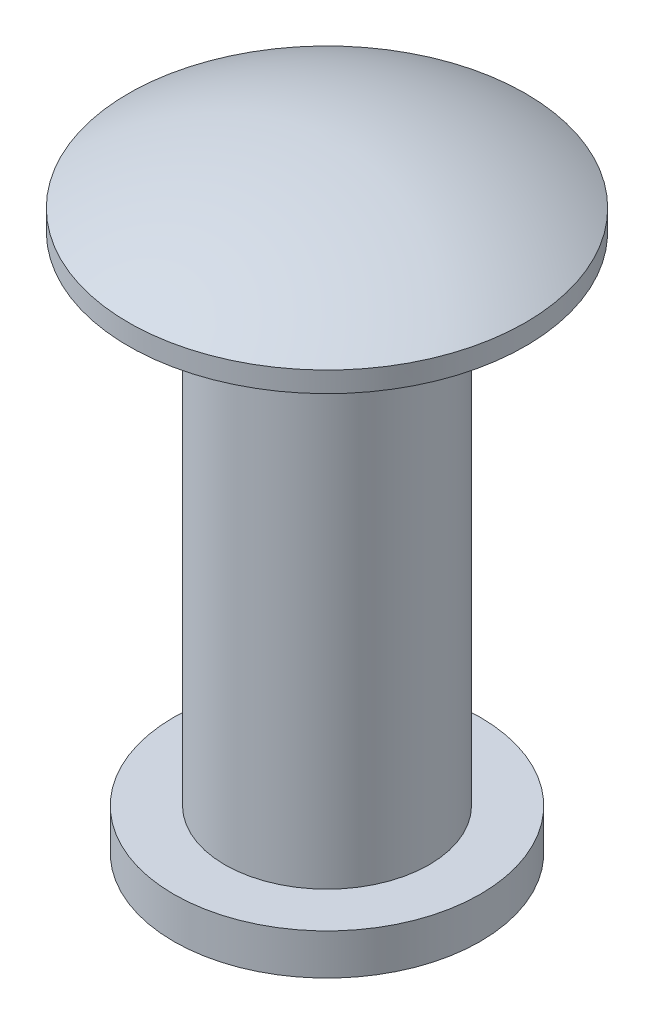
from build123d import *

# Parameters (mm, degrees)
SKETCH_1_W = 4.711910786
SKETCH_1_H = 1


with BuildPart() as part:
    # Эскиз1 → Повернуть1 (revolve)
    with BuildSketch(Plane.XY, mode=Mode.PRIVATE) as revolve_1_sk:
        with BuildLine():
            Line((7.5, 0), (5, 0))
            Line((5, 0), (5, 24.33030278))
            Line((5, 24.33030278), (5, 25.33030278))
            Line((5, 25.33030278), (5, 27.33030278))
            ThreePointArc((5, 27.33030278), (2.522325037, 27.831831467), (0, 28))
            Line((0, 28), (0, 26.5))
            Line((0, 26.5), (2.5, 26.5))
            Line((2.5, 26.5), (2.5, 26))
            Line((2.5, 26), (3.75, 26))
            Line((3.75, 26), (3.75, -2))
            Line((3.75, -2), (7.5, -2))
            Line((7.5, -2), (7.5, 0))
        make_face()
        with BuildLine():
            Line((5, 27.33030278), (5, 25.33030278))
            Line((5, 25.33030278), (9.711910786, 25.33030278))
            ThreePointArc((9.711910786, 25.33030278), (7.423616352, 26.489708981), (5, 27.33030278))
        make_face()
        with Locations((7.355955393, 24.83030278)):
            Rectangle(SKETCH_1_W, SKETCH_1_H)
    revolve(revolve_1_sk.sketch.rotate(Axis((0, -22.043249972, 0), (0, 1, 0)), 90), axis=Axis((0, -22.043249972, 0), (0, 1, 0)))


solid = part.part
